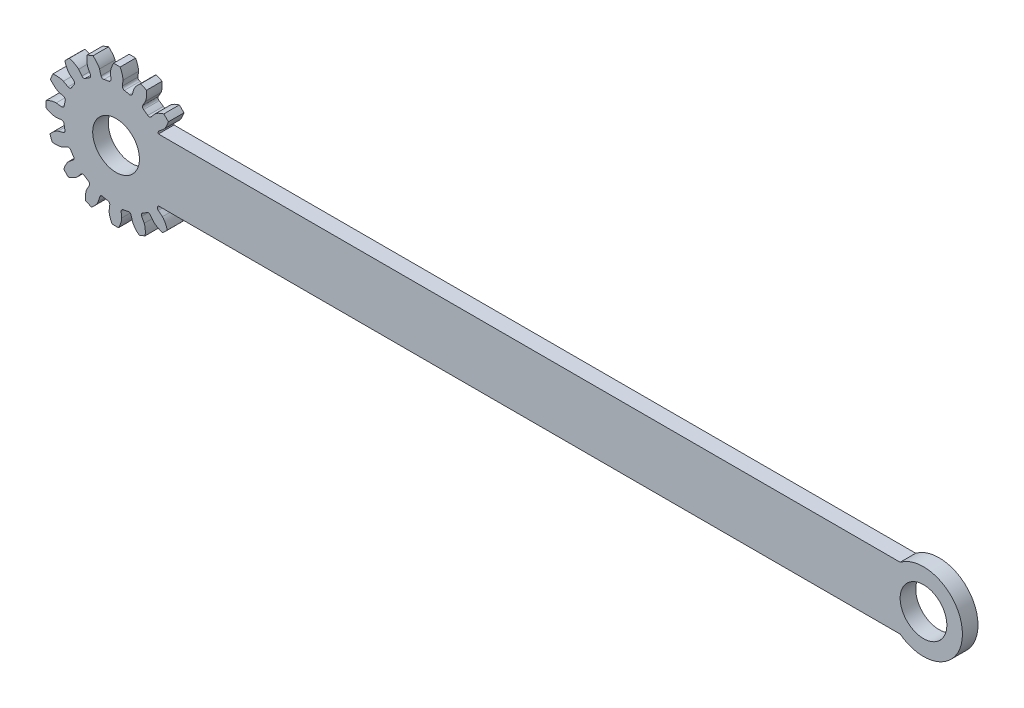
from build123d import *

# Parameters (mm, degrees)
BOSS_EXTRUDE1_DEPTH      = 3.175
CUT_EXTRUDE1_DEPTH       = 174.238840876
FILLET1_R                = 0.496244564
CIRPATTERN1_COUNT        = 16
FILLET1_OF_CIRPATTERN1_R = 0.496244564
SKETCH4_W                = 3.175
SKETCH4_H                = 12.7
BOSS_EXTRUDE2_DEPTH      = 5.08
SKETCH5_R                = 4.7625
CUT_EXTRUDE2_DEPTH       = 174.238840986


with BuildPart() as part:
    # Sketch1 → Boss-Extrude1 (new body)
    with BuildSketch(Plane.XY):
        with BuildLine():
            Line((12.798834175, -6.35), (159.919473719, -6.35))
            ThreePointArc((159.919473719, -6.35), (172.619473719, 0), (159.919473719, 6.35))
            Line((159.919473719, 6.35), (12.798834175, 6.35))
            ThreePointArc((12.798834175, 6.35), (-14.2875, 0), (12.798834175, -6.35))
        make_face()
    extrude(amount=BOSS_EXTRUDE1_DEPTH)

    # Sketch3 → Cut-Extrude1 (cut, through all)
    with BuildSketch(Plane.XY.offset(3.175)):
        with BuildLine():
            Line((10.304535783, 2.93958525), (11.823777189, 3.372980769))
            add(Edge.make_bspline(
                [(11.823777189, 3.372980769), (11.826828122, 3.373892569), (11.835350142, 3.376568337), (11.851321191, 3.382094065), (11.877172543, 3.391770902), (11.909795337, 3.405068504), (11.951582688, 3.42336192), (12.000307705, 3.446328962), (12.053311702, 3.473046741), (12.110372018, 3.503701368), (12.166747224, 3.535680762), (12.222457493, 3.568875739), (12.277469218, 3.603106176), (12.343518338, 3.645937307), (12.421890668, 3.699191843), (12.51225172, 3.764180094), (12.613236283, 3.84110705), (12.714502029, 3.922921917), (12.812770185, 4.006222816), (12.910423586, 4.093569134), (13.00374758, 4.180333952), (13.098951244, 4.273675723), (13.185952071, 4.361475552), (13.28145445, 4.463366885), (13.35795476, 4.546626366), (13.435301406, 4.635544323), (13.472697325, 4.679249473), (13.491703323, 4.70176538)],
                knots=[0, 0, 0, 0, 0, 0.005376749, 0.015083688, 0.02853182, 0.04661014, 0.064854849, 0.092110526, 0.119476176, 0.146842496, 0.174208854, 0.201574956, 0.228941013, 0.256307345, 0.307035032, 0.361767352, 0.416499661, 0.471231937, 0.525964282, 0.580696616, 0.635428982, 0.690161387, 0.744893688, 0.799626082, 0.854358407, 0.909090915, 0.909090915, 0.909090915, 0.909090915, 0.909090915], degree=4))
            ThreePointArc((13.491703323, 4.70176538), (14.043018272, 2.631785339), (14.278655565, 0.502644525))
            add(Edge.make_bspline(
                [(12.242763285, 1.137300936), (12.245937342, 1.137555753), (12.254849948, 1.138147388), (12.271738056, 1.138779756), (12.299339098, 1.139120368), (12.334563147, 1.138537862), (12.380138823, 1.136617047), (12.433873689, 1.132851889), (12.492955303, 1.127139941), (12.557243503, 1.119227096), (12.621372784, 1.109831304), (12.685322412, 1.099061646), (12.748995841, 1.087073853), (12.826071969, 1.071065653), (12.918409361, 1.049803624), (13.026170688, 1.021945252), (13.148157611, 0.986805116), (13.272176548, 0.947210583), (13.393939406, 0.905145435), (13.516594072, 0.85908679), (13.635002567, 0.812002506), (13.757544691, 0.759468213), (13.87043389, 0.709129536), (13.996350253, 0.648734026), (14.097807449, 0.59882535), (14.202102483, 0.543948644), (14.252786319, 0.516750416), (14.278655565, 0.502644525)],
                knots=[0, 0, 0, 0, 0, 0.005376749, 0.015083688, 0.02853182, 0.04661014, 0.064854849, 0.092110526, 0.119476176, 0.146842496, 0.174208854, 0.201574956, 0.228941013, 0.256307345, 0.307035032, 0.361767352, 0.416499661, 0.471231937, 0.525964282, 0.580696616, 0.635428982, 0.690161387, 0.744893688, 0.799626082, 0.854358407, 0.909090915, 0.909090915, 0.909090915, 0.909090915, 0.909090915], degree=4))
            Line((12.242763285, 1.137300936), (10.669686204, 0.991168727))
            ThreePointArc((10.669686204, 0.991168727), (10.532263704, 1.973839004), (10.304535783, 2.93958525))
        make_face()
    cut_extrude1 = extrude(amount=-CUT_EXTRUDE1_DEPTH, mode=Mode.SUBTRACT)

    # Fillet1
    fillet1_edges = [part.edges().sort_by_distance(p)[0] for p in [
        (10.669686204, 0.991168727, 1.5875),
        (10.304535783, 2.93958525, 1.5875),
    ]]
    fillet(fillet1_edges, radius=FILLET1_R)

    # CirPattern1: Cut-Extrude1 ×16 about axis
    cirpattern1_axis = Axis((0, 0, 3.175), (0, 0, 1))
    for i in range(1, CIRPATTERN1_COUNT):
        add(cut_extrude1.rotate(cirpattern1_axis, i * 360 / CIRPATTERN1_COUNT), mode=Mode.SUBTRACT)

    # Fillet1 of CirPattern1
    fillet1_of_cirpattern1_edges = [part.edges().sort_by_distance(p)[0] for p in [
        (9.478200852, 4.998832639, 1.5875),
        (8.395219128, 6.659197769, 1.5875),
        (6.84374534, 8.245469596, 1.5875),
        (5.207806465, 9.365007793, 1.5875),
        (3.167391638, 10.236808553, 1.5875),
        (1.227552476, 10.645080275, 1.5875),
        (-0.991168727, 10.669686204, 1.5875),
        (-2.93958525, 10.304535783, 1.5875),
        (-4.998832639, 9.478200852, 1.5875),
        (-6.659197769, 8.395219128, 1.5875),
        (-8.245469596, 6.84374534, 1.5875),
        (-9.365007793, 5.207806465, 1.5875),
        (-10.236808553, 3.167391638, 1.5875),
        (-10.645080275, 1.227552476, 1.5875),
        (-10.669686204, -0.991168727, 1.5875),
        (-10.304535783, -2.93958525, 1.5875),
        (-9.478200852, -4.998832639, 1.5875),
        (-8.395219128, -6.659197769, 1.5875),
        (-6.84374534, -8.245469596, 1.5875),
        (-5.207806465, -9.365007793, 1.5875),
        (-3.167391638, -10.236808553, 1.5875),
        (-1.227552476, -10.645080275, 1.5875),
        (0.991168727, -10.669686204, 1.5875),
        (2.93958525, -10.304535783, 1.5875),
        (4.998832639, -9.478200852, 1.5875),
        (6.659197769, -8.395219128, 1.5875),
        (8.245469596, -6.84374534, 1.5875),
        (9.365007793, -5.207806465, 1.5875),
        (10.236808553, -3.167391638, 1.5875),
        (10.645080275, -1.227552476, 1.5875),
    ]]
    fillet(fillet1_of_cirpattern1_edges, radius=FILLET1_OF_CIRPATTERN1_R)

    # Sketch4 → Boss-Extrude2 (add, symmetric)
    with BuildSketch(Plane(origin=(10.16, 0, 0), x_dir=(0, 0, -1), z_dir=(1, 0, 0))):
        with Locations((-1.5875, 0)):
            Rectangle(SKETCH4_W, SKETCH4_H)
    extrude(amount=BOSS_EXTRUDE2_DEPTH, both=True)

    # Sketch5 → Cut-Extrude2 (cut, through all)
    with BuildSketch(Plane.XY.offset(3.175)):
        Circle(SKETCH5_R)
        with Locations((164.681973719, 0)):
            Circle(SKETCH5_R)
    extrude(amount=-CUT_EXTRUDE2_DEPTH, mode=Mode.SUBTRACT)


solid = part.part
